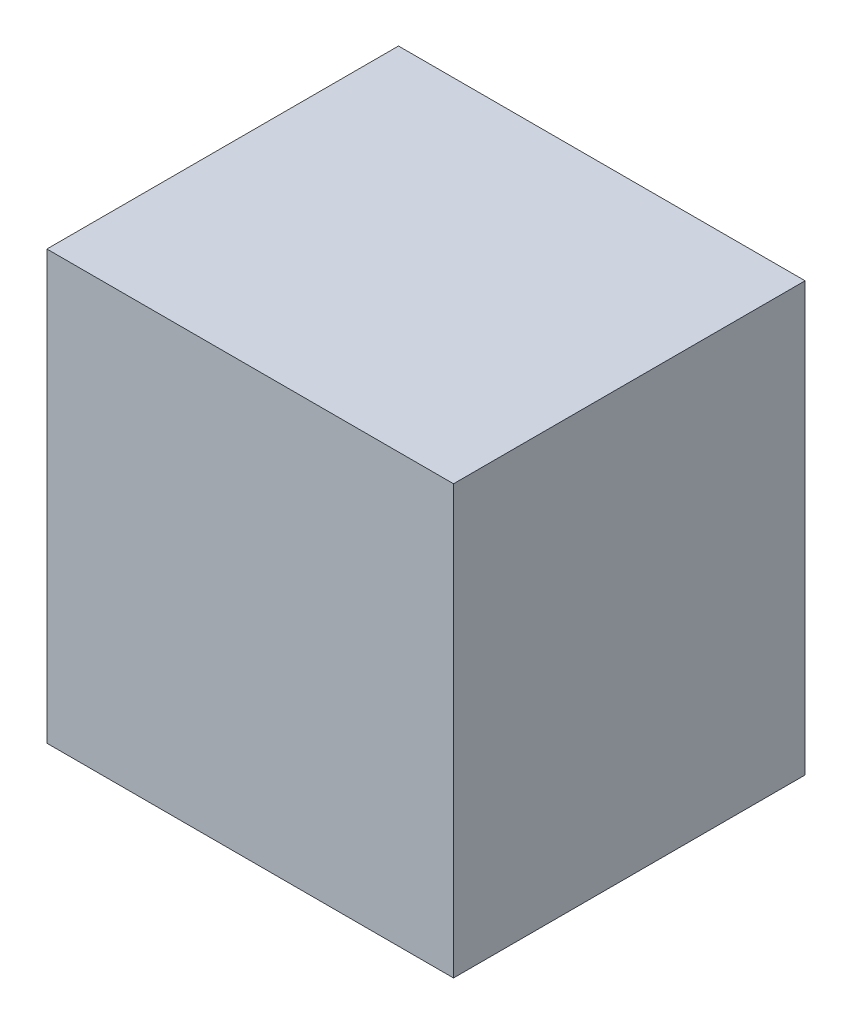
from build123d import *

# Parameters (mm, degrees)
SKETCH1_W           = 26.6
SKETCH1_H           = 23
BOSS_EXTRUDE1_DEPTH = 28


with BuildPart() as part:
    # Sketch1 → Boss-Extrude1 (new body)
    with BuildSketch(Plane(origin=(0, 0, 0), x_dir=(1, 0, 0), z_dir=(0, 1, 0))):
        Rectangle(SKETCH1_W, SKETCH1_H)
    extrude(amount=BOSS_EXTRUDE1_DEPTH)


solid = part.part
